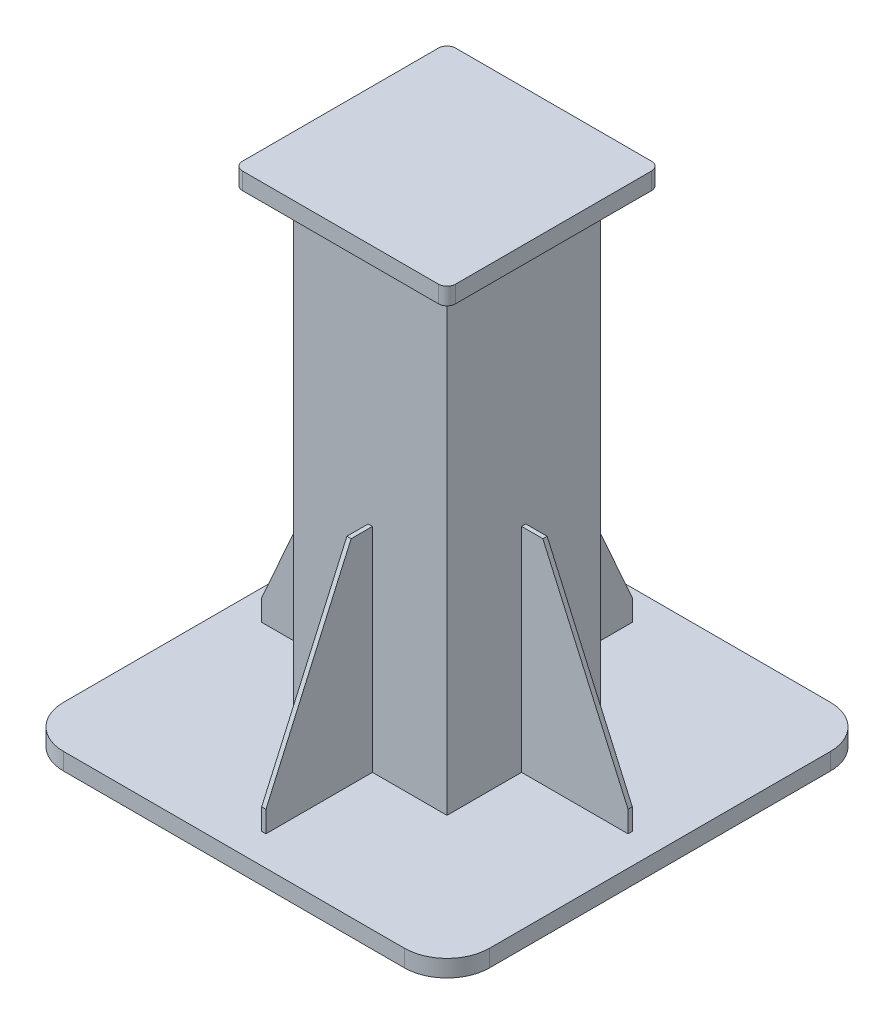
from build123d import *

# Parameters (mm, degrees)
SKETCH1_W           = 500
SKETCH1_H           = 500
BOSS_EXTRUDE1_DEPTH = 20
SKETCH2_W           = 180
SKETCH2_H           = 180
BOSS_EXTRUDE2_DEPTH = 550
SKETCH3_W           = 250
SKETCH3_H           = 250
BOSS_EXTRUDE3_DEPTH = 20
GUSSET1_THICKNESS   = 5
GUSSET2_THICKNESS   = 5
GUSSET3_THICKNESS   = 5
GUSSET4_THICKNESS   = 5
FILLET1_R           = 10
FILLET2_R           = 50


with BuildPart() as part:
    # Sketch1 → Boss-Extrude1 (new body)
    with BuildSketch(Plane(origin=(0, 0, 0), x_dir=(1, 0, 0), z_dir=(0, 1, 0))):
        Rectangle(SKETCH1_W, SKETCH1_H)
    extrude(amount=BOSS_EXTRUDE1_DEPTH)

    # Sketch2 → Boss-Extrude2 (add)
    with BuildSketch(Plane(origin=(0, 20, 0), x_dir=(1, 0, 0), z_dir=(0, 1, 0))):
        Rectangle(SKETCH2_W, SKETCH2_H)
    extrude(amount=BOSS_EXTRUDE2_DEPTH)

    # Sketch3 → Boss-Extrude3 (add)
    with BuildSketch(Plane(origin=(0, 570, 0), x_dir=(1, 0, 0), z_dir=(0, 1, 0))):
        Rectangle(SKETCH3_W, SKETCH3_H)
    extrude(amount=BOSS_EXTRUDE3_DEPTH)

    # Fillet1
    fillet1_edges = [part.edges().sort_by_distance(p)[0] for p in [
        (-125, 580, -125),
        (-125, 580, 125),
        (125, 580, 125),
        (125, 580, -125),
    ]]
    fillet(fillet1_edges, radius=FILLET1_R)

    # Fillet2
    fillet2_edges = [part.edges().sort_by_distance(p)[0] for p in [
        (-250, 10, -250),
        (250, 10, -250),
        (250, 10, 250),
        (-250, 10, 250),
    ]]
    fillet(fillet2_edges, radius=FILLET2_R)


with BuildPart() as body_2:
    # Gusset1: a gusset: a plate 5.0 thick in the corner of two members, its outline drawn in place
    gusset1_outline = Wire([Line((2.5, 20, 90), (2.5, 270, 90)), Line((2.5, 270, 90), (2.5, 270, 115)), Line((2.5, 270, 115), (2.5, 45, 215)), Line((2.5, 45, 215), (2.5, 20, 215)), Line((2.5, 20, 215), (2.5, 20, 90))])
    add(extrude(Face(gusset1_outline), amount=GUSSET1_THICKNESS, dir=(-1, 0, 0)))


with BuildPart() as body_3:
    # Gusset2: a gusset: a plate 5.0 thick in the corner of two members, its outline drawn in place
    gusset2_outline = Wire([Line((-90, 20, 2.5), (-90, 270, 2.5)), Line((-90, 270, 2.5), (-115, 270, 2.5)), Line((-115, 270, 2.5), (-215, 45, 2.5)), Line((-215, 45, 2.5), (-215, 20, 2.5)), Line((-215, 20, 2.5), (-90, 20, 2.5))])
    add(extrude(Face(gusset2_outline), amount=GUSSET2_THICKNESS, dir=(0, 0, -1)))


with BuildPart() as body_4:
    # Gusset3: a gusset: a plate 5.0 thick in the corner of two members, its outline drawn in place
    gusset3_outline = Wire([Line((90, 20, -2.5), (90, 270, -2.5)), Line((90, 270, -2.5), (115, 270, -2.5)), Line((115, 270, -2.5), (215, 45, -2.5)), Line((215, 45, -2.5), (215, 20, -2.5)), Line((215, 20, -2.5), (90, 20, -2.5))])
    add(extrude(Face(gusset3_outline), amount=GUSSET3_THICKNESS, dir=(0, 0, 1)))


with BuildPart() as body_5:
    # Gusset4: a gusset: a plate 5.0 thick in the corner of two members, its outline drawn in place
    gusset4_outline = Wire([Line((-2.5, 20, -90), (-2.5, 270, -90)), Line((-2.5, 270, -90), (-2.5, 270, -115)), Line((-2.5, 270, -115), (-2.5, 45, -215)), Line((-2.5, 45, -215), (-2.5, 20, -215)), Line((-2.5, 20, -215), (-2.5, 20, -90))])
    add(extrude(Face(gusset4_outline), amount=GUSSET4_THICKNESS, dir=(1, 0, 0)))


solid = Compound([part.part, body_2.part, body_3.part, body_4.part, body_5.part])
